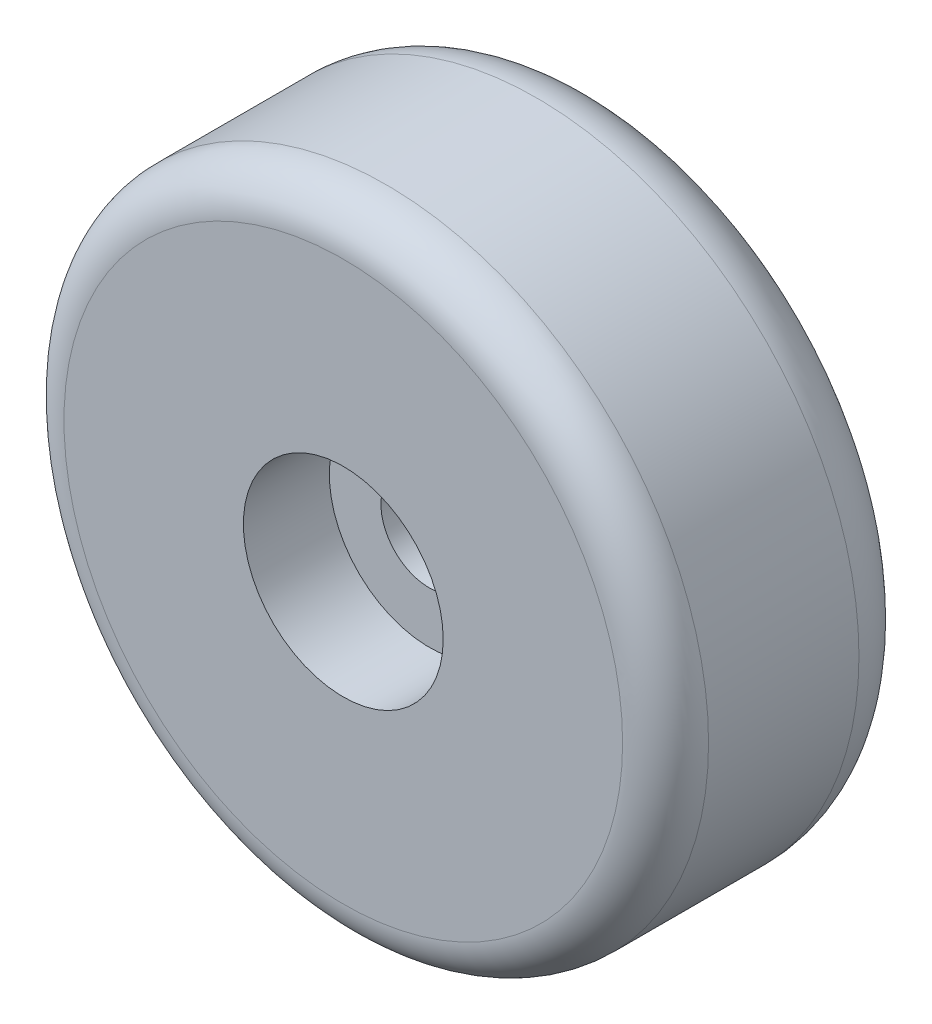
from build123d import *

# Parameters (mm, degrees)
SKETCH_1_R          = 15
SKETCH_1_R_2        = 2.25
EXTRUDE_1_DEPTH     = 12
SKETCH_2_R          = 4.65
CUT_EXTRUDE_1_DEPTH = 4
FILLET_1_R          = 2
FILLET_2_R          = 3


with BuildPart() as part:
    # Эскиз1 → Бобышка-Вытянуть1 (new body)
    with BuildSketch(Plane.XY):
        Circle(SKETCH_1_R)
        Circle(SKETCH_1_R_2, mode=Mode.SUBTRACT)
    extrude(amount=EXTRUDE_1_DEPTH)

    # Эскиз2 → Вырез-Вытянуть1 (cut)
    with BuildSketch(Plane.XY.offset(12)):
        Circle(SKETCH_2_R)
    extrude(amount=-CUT_EXTRUDE_1_DEPTH, mode=Mode.SUBTRACT)

    # Скругление1
    fillet_1_edges = [part.edges().sort_by_distance(p)[0] for p in [
        (-15, 0, 12),
    ]]
    fillet(fillet_1_edges, radius=FILLET_1_R)

    # Скругление2
    fillet_2_edges = [part.edges().sort_by_distance(p)[0] for p in [
        (-15, 0, 0),
    ]]
    fillet(fillet_2_edges, radius=FILLET_2_R)


solid = part.part
